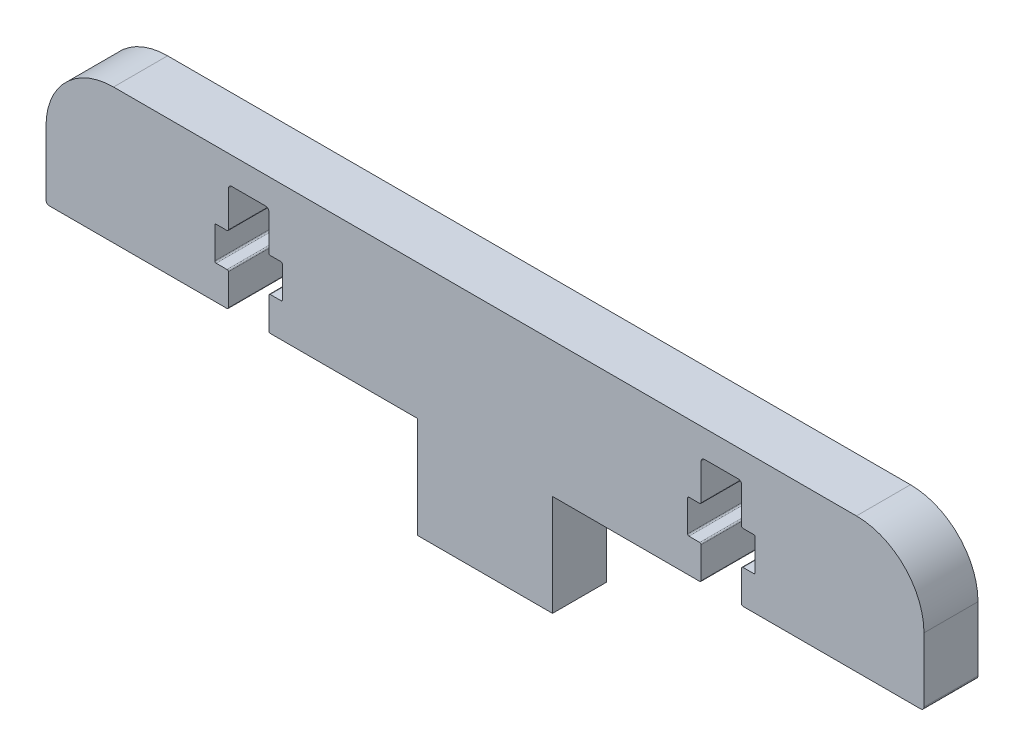
from build123d import *

# Parameters (mm, degrees)
BOSS_EXTRUDE1_DEPTH = 8


with BuildPart() as part:
    # Model → Boss-Extrude1 (new body)
    with BuildSketch(Plane.XY):
        with BuildLine():
            Line((-65, -10), (-65, -19.5))
            ThreePointArc((-65, -19.5), (-64.853553391, -19.853553391), (-64.5, -20))
            Line((-64.5, -20), (-38.2, -20))
            ThreePointArc((-38.2, -20), (-38.058578644, -19.941421356), (-38, -19.8))
            Line((-38, -19.8), (-38, -15.2))
            ThreePointArc((-38, -15.2), (-38.058578644, -15.058578644), (-38.2, -15))
            Line((-38.2, -15), (-39.8, -15))
            ThreePointArc((-39.8, -15), (-39.941421356, -14.941421356), (-40, -14.8))
            Line((-40, -14.8), (-40, -10.2))
            ThreePointArc((-40, -10.2), (-39.941421356, -10.058578644), (-39.8, -10))
            Line((-39.8, -10), (-38.2, -10))
            ThreePointArc((-38.2, -10), (-38.058578644, -9.941421356), (-38, -9.8))
            Line((-38, -9.8), (-38, -4.5))
            ThreePointArc((-38, -4.5), (-37.853553391, -4.146446609), (-37.5, -4))
            Line((-37.5, -4), (-32.5, -4))
            ThreePointArc((-32.5, -4), (-32.146446609, -4.146446609), (-32, -4.5))
            Line((-32, -4.5), (-32, -9.8))
            ThreePointArc((-32, -9.8), (-31.941421356, -9.941421356), (-31.8, -10))
            Line((-31.8, -10), (-30.2, -10))
            ThreePointArc((-30.2, -10), (-30.058578644, -10.058578644), (-30, -10.2))
            Line((-30, -10.2), (-30, -14.8))
            ThreePointArc((-30, -14.8), (-30.058578644, -14.941421356), (-30.2, -15))
            Line((-30.2, -15), (-31.8, -15))
            ThreePointArc((-31.8, -15), (-31.941421356, -15.058578644), (-32, -15.2))
            Line((-32, -15.2), (-32, -19.8))
            ThreePointArc((-32, -19.8), (-31.941421356, -19.941421356), (-31.8, -20))
            Line((-31.8, -20), (-10, -20))
            Line((-10, -20), (-10, -35))
            Line((-10, -35), (10, -35))
            Line((10, -35), (10, -20))
            Line((10, -20), (31.8, -20))
            ThreePointArc((31.8, -20), (31.941421356, -19.941421356), (32, -19.8))
            Line((32, -19.8), (32, -15.2))
            ThreePointArc((32, -15.2), (31.941421356, -15.058578644), (31.8, -15))
            Line((31.8, -15), (30.2, -15))
            ThreePointArc((30.2, -15), (30.058578644, -14.941421356), (30, -14.8))
            Line((30, -14.8), (30, -10.2))
            ThreePointArc((30, -10.2), (30.058578644, -10.058578644), (30.2, -10))
            Line((30.2, -10), (31.8, -10))
            ThreePointArc((31.8, -10), (31.941421356, -9.941421356), (32, -9.8))
            Line((32, -9.8), (32, -4.5))
            ThreePointArc((32, -4.5), (32.146446609, -4.146446609), (32.5, -4))
            Line((32.5, -4), (37.5, -4))
            ThreePointArc((37.5, -4), (37.853553391, -4.146446609), (38, -4.5))
            Line((38, -4.5), (38, -9.8))
            ThreePointArc((38, -9.8), (38.058578644, -9.941421356), (38.2, -10))
            Line((38.2, -10), (39.8, -10))
            ThreePointArc((39.8, -10), (39.941421356, -10.058578644), (40, -10.2))
            Line((40, -10.2), (40, -14.8))
            ThreePointArc((40, -14.8), (39.941421356, -14.941421356), (39.8, -15))
            Line((39.8, -15), (38.2, -15))
            ThreePointArc((38.2, -15), (38.058578644, -15.058578644), (38, -15.2))
            Line((38, -15.2), (38, -19.8))
            ThreePointArc((38, -19.8), (38.058578644, -19.941421356), (38.2, -20))
            Line((38.2, -20), (64.5, -20))
            ThreePointArc((64.5, -20), (64.853553391, -19.853553391), (65, -19.5))
            Line((65, -19.5), (65, -10))
            ThreePointArc((65, -10), (62.071067812, -2.928932188), (55, 0))
            Line((55, 0), (-55, 0))
            ThreePointArc((-55, 0), (-62.071067812, -2.928932188), (-65, -10))
        make_face()
    extrude(amount=BOSS_EXTRUDE1_DEPTH)


solid = part.part
